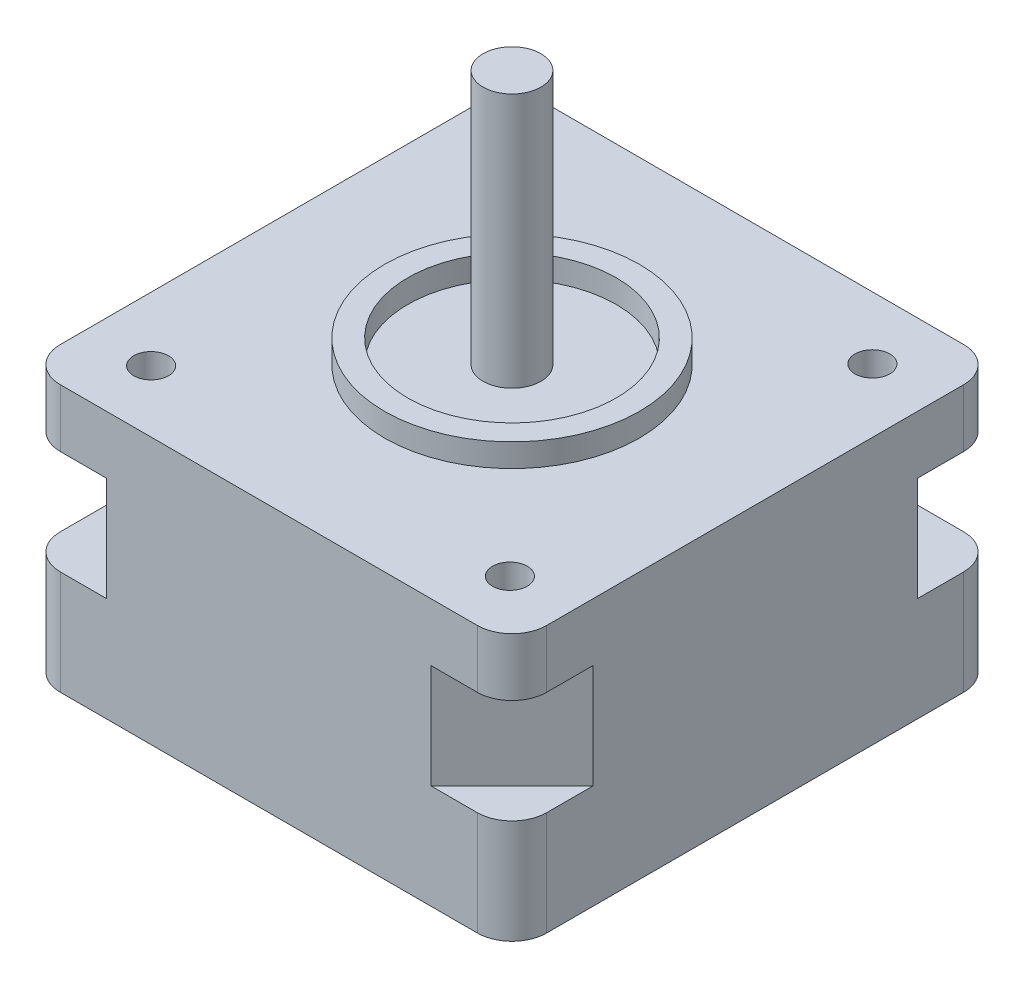
from build123d import *

# Parameters (mm, degrees)
BOSS_EXTRUDE1_DEPTH = 9
BOSS_EXTRUDE2_DEPTH = 9
BOSS_EXTRUDE3_DEPTH = 5
SKETCH5_R           = 11
SKETCH5_R_2         = 9
BOSS_EXTRUDE4_DEPTH = 2
SKETCH6_R           = 2.5
BOSS_EXTRUDE5_DEPTH = 22
SKETCH7_R           = 1.5
CUT_EXTRUDE1_DEPTH  = 4.5
SKETCH9_W           = 15
SKETCH9_H           = 5
BOSS_EXTRUDE6_DEPTH = 5


with BuildPart() as part:
    # Sketch2 → Boss-Extrude1 (new body)
    with BuildSketch(Plane(origin=(0, 0, 0), x_dir=(1, 0, 0), z_dir=(0, 1, 0))):
        with BuildLine():
            Line((-18, 21), (18, 21))
            ThreePointArc((18, 21), (20.121320344, 20.121320344), (21, 18))
            Line((21, 18), (21, -18))
            ThreePointArc((21, -18), (20.121320344, -20.121320344), (18, -21))
            Line((18, -21), (-18, -21))
            ThreePointArc((-18, -21), (-20.121320344, -20.121320344), (-21, -18))
            Line((-21, -18), (-21, 18))
            ThreePointArc((-21, 18), (-20.121320344, 20.121320344), (-18, 21))
        make_face()
    extrude(amount=BOSS_EXTRUDE1_DEPTH)

    # Sketch3 → Boss-Extrude2 (add)
    with BuildSketch(Plane(origin=(0, 9, 0), x_dir=(1, 0, 0), z_dir=(0, 1, 0))):
        Polygon((-21, 14), (-14, 21), (14, 21), (21, 14), (21, -14), (14, -21), (-14, -21), (-21, -14), align=None)
    extrude(amount=BOSS_EXTRUDE2_DEPTH)

    # Sketch4 → Boss-Extrude3 (add)
    with BuildSketch(Plane(origin=(0, 18, 0), x_dir=(1, 0, 0), z_dir=(0, 1, 0))):
        with BuildLine():
            Line((-18, 21), (18, 21))
            ThreePointArc((18, 21), (20.121320344, 20.121320344), (21, 18))
            Line((21, 18), (21, -18))
            ThreePointArc((21, -18), (20.121320344, -20.121320344), (18, -21))
            Line((18, -21), (-18, -21))
            ThreePointArc((-18, -21), (-20.121320344, -20.121320344), (-21, -18))
            Line((-21, -18), (-21, 18))
            ThreePointArc((-21, 18), (-20.121320344, 20.121320344), (-18, 21))
        make_face()
    extrude(amount=BOSS_EXTRUDE3_DEPTH)

    # Sketch5 → Boss-Extrude4 (add)
    with BuildSketch(Plane(origin=(0, 23, 0), x_dir=(1, 0, 0), z_dir=(0, 1, 0))):
        with Locations(Location((0, 0, 0), (0, 0, 270))):
            Circle(SKETCH5_R)
        with Locations(Location((0, 0, 0), (0, 0, 270))):
            Circle(SKETCH5_R_2, mode=Mode.SUBTRACT)
    extrude(amount=BOSS_EXTRUDE4_DEPTH)

    # Sketch6 → Boss-Extrude5 (add)
    with BuildSketch(Plane(origin=(0, 23, 0), x_dir=(1, 0, 0), z_dir=(0, 1, 0))):
        with Locations(Location((0, 0, 0), (0, 0, 270))):
            Circle(SKETCH6_R)
    extrude(amount=BOSS_EXTRUDE5_DEPTH)

    # Sketch7 → Cut-Extrude1 (cut)
    with BuildSketch(Plane(origin=(0, 23, 0), x_dir=(1, 0, 0), z_dir=(0, 1, 0))):
        with Locations(Location((-15.5, 15.5, 0), (0, 0, 270))):
            Circle(SKETCH7_R)
        with Locations(Location((15.505550331, 15.61144176, 0), (0, 0, 270))):
            Circle(SKETCH7_R)
        with Locations(Location((15.732618971, -15.912931541, 0), (0, 0, 270))):
            Circle(SKETCH7_R)
        with Locations(Location((-15.494867745, -15.663236697, 0), (0, 0, 270))):
            Circle(SKETCH7_R)
    extrude(amount=-CUT_EXTRUDE1_DEPTH, mode=Mode.SUBTRACT)

    # Sketch9 → Boss-Extrude6 (add)
    with BuildSketch(Plane(origin=(0, 0, -21), x_dir=(-1, 0, 0), z_dir=(0, 0, -1))):
        with Locations((0, 6.5)):
            Rectangle(SKETCH9_W, SKETCH9_H)
    extrude(amount=BOSS_EXTRUDE6_DEPTH)


solid = part.part
